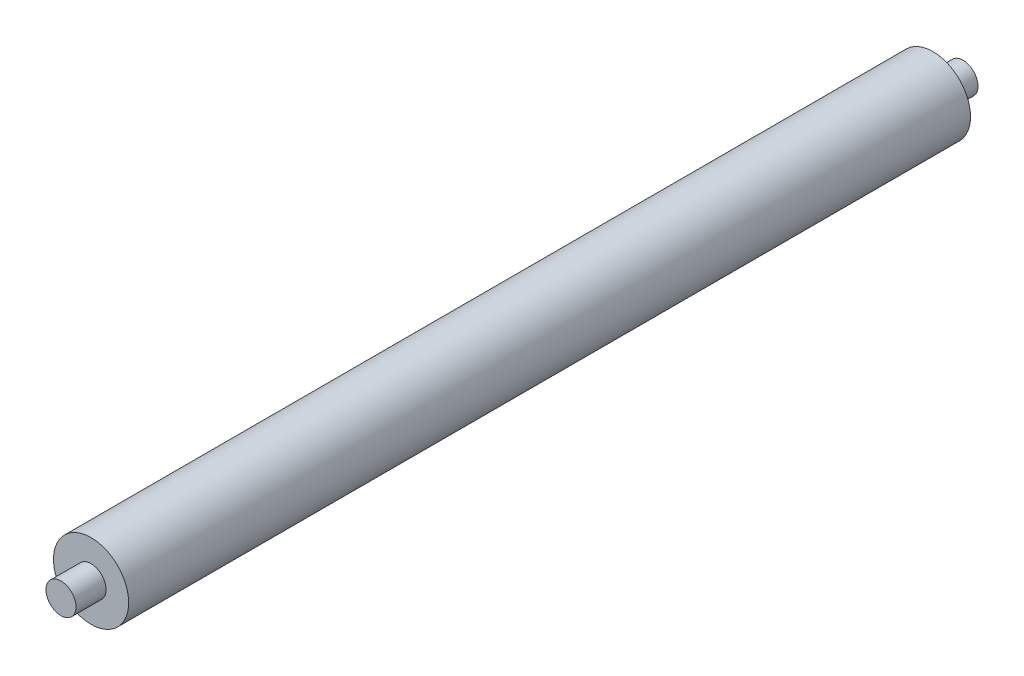
from build123d import *

# Parameters (mm, degrees)
SKETCH1_R           = 12.5
BOSS_EXTRUDE1_DEPTH = 280
SKETCH2_R           = 5
BOSS_EXTRUDE2_DEPTH = 10
BOSS_EXTRUDE3_START = 10
SKETCH3_R           = 5
BOSS_EXTRUDE3_DEPTH = 10


with BuildPart() as part:
    # Sketch1 → Boss-Extrude1 (new body)
    with BuildSketch(Plane.XY):
        Circle(SKETCH1_R)
    extrude(amount=BOSS_EXTRUDE1_DEPTH)

    # Sketch2 → Boss-Extrude2 (add)
    with BuildSketch(Plane.XY.offset(280)):
        Circle(SKETCH2_R)
    extrude(amount=BOSS_EXTRUDE2_DEPTH)

    # Sketch3 → Boss-Extrude3 (add)
    with BuildSketch(Plane(origin=(0, 0, 0), x_dir=(-1, 0, 0), z_dir=(0, 0, -1)).offset(BOSS_EXTRUDE3_START)):
        with Locations(Location((0, 0, 0), (0, 0, 180))):
            Circle(SKETCH3_R)
    extrude(amount=-BOSS_EXTRUDE3_DEPTH)


solid = part.part
